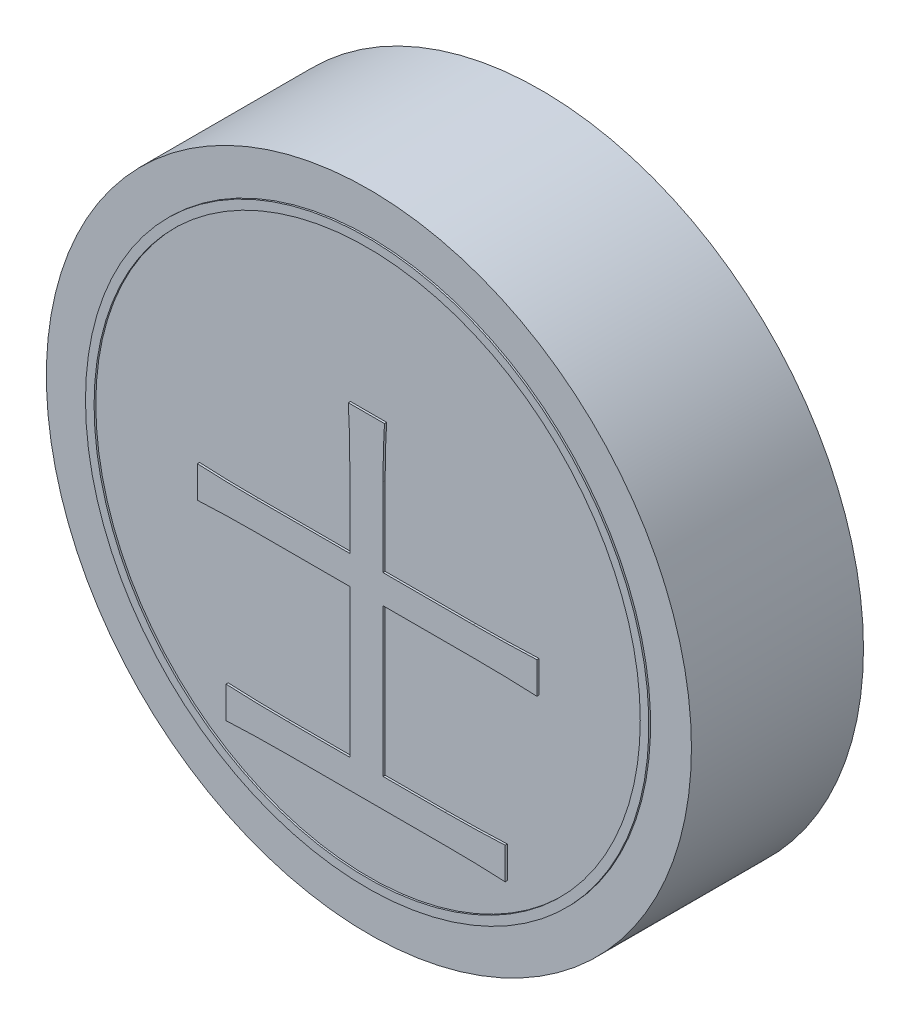
from build123d import *

# Parameters (mm, degrees)
SKETCH_1_R               = 15
DIAMETER30_HEIGHT8_DEPTH = 8
CHARACTER_DEPTH          = 0.1
SKETCH_3_R               = 13.1
SKETCH_3_R_2             = 12.7
INK_RING_DEPTH           = 0.08


with BuildPart() as part:
    # 草图1 → Diameter30_Height8 (new body)
    with BuildSketch(Plane.XY):
        Circle(SKETCH_1_R)
    extrude(amount=-DIAMETER30_HEIGHT8_DEPTH)

    # 草图2 → Character_士 (add)
    with BuildSketch(Plane.XY):
        with BuildLine():
            add(Edge.make_bspline(
                [(0.824561404, 6.026315789), (0.813336636, 5.83662132), (0.790538423, 5.45133988), (0.771428603, 4.863755794), (0.757740418, 4.258132362), (0.755515021, 3.84828648), (0.754385965, 3.640350877)],
                knots=[0, 0, 0, 0, 0.955126267, 1.939921735, 2.954817811, 4, 4, 4, 4], degree=3))
            Line((0.754385965, 3.640350877), (0.754385965, -0.00877193))
            Line((0.754385965, -0.00877193), (4.964912281, -0.00877193))
            add(Edge.make_bspline(
                [(4.964912281, -0.00877193), (5.184108112, -0.007529011), (5.640726, -0.004939824), (6.351162704, 0.009012072), (7.114519154, 0.028890494), (7.640265954, 0.050317465), (7.912280702, 0.061403509)],
                knots=[0, 0, 0, 0, 0.89213577, 1.858452998, 2.891990654, 4, 4, 4, 4], degree=3))
            Line((7.912280702, 0.061403509), (7.912280702, -1.412280702))
            add(Edge.make_bspline(
                [(7.912280702, -1.412280702), (7.427185378, -1.392141242), (6.468519002, -1.352340771), (5.509053521, -1.345489646), (5.035087719, -1.342105263)],
                knots=[0, 0, 0, 0, 1.012021148, 2, 2, 2, 2], degree=3))
            Line((5.035087719, -1.342105263), (0.754385965, -1.342105263))
            Line((0.754385965, -1.342105263), (0.754385965, -8.219298246))
            Line((0.754385965, -8.219298246), (3.631578947, -8.219298246))
            add(Edge.make_bspline(
                [(3.631578947, -8.219298246), (3.848176317, -8.218087826), (4.292668001, -8.215603856), (4.977115293, -8.20161515), (5.696306453, -8.181989949), (6.187377565, -8.160246287), (6.438596491, -8.149122807)],
                knots=[0, 0, 0, 0, 0.925596292, 1.899468382, 2.925423867, 4, 4, 4, 4], degree=3))
            Line((6.438596491, -8.149122807), (6.438596491, -9.622807018))
            add(Edge.make_bspline(
                [(6.438596491, -9.622807018), (6.22377323, -9.611572963), (5.785618359, -9.588659914), (5.114015233, -9.569582266), (4.416560018, -9.555980066), (3.942610691, -9.553759864), (3.701754386, -9.552631579)],
                knots=[0, 0, 0, 0, 0.942753637, 1.922846234, 2.944411245, 4, 4, 4, 4], degree=3))
            Line((3.701754386, -9.552631579), (-3.666666667, -9.552631579))
            add(Edge.make_bspline(
                [(-3.666666667, -9.552631579), (-3.919651707, -9.553757661), (-4.416990585, -9.555971406), (-5.149099093, -9.569586009), (-5.855343836, -9.588750323), (-6.316905199, -9.61158096), (-6.543859649, -9.622807018)],
                knots=[0, 0, 0, 0, 1.05470571, 2.07342756, 3.052684594, 4, 4, 4, 4], degree=3))
            Line((-6.543859649, -9.622807018), (-6.543859649, -8.149122807))
            add(Edge.make_bspline(
                [(-6.543859649, -8.149122807), (-6.326438065, -8.160395624), (-5.876165846, -8.183741218), (-5.178554503, -8.202420094), (-4.436918096, -8.216076814), (-3.928315814, -8.218203947), (-3.666666667, -8.219298246)],
                knots=[0, 0, 0, 0, 0.907617697, 1.879643343, 2.909187922, 4, 4, 4, 4], degree=3))
            Line((-3.666666667, -8.219298246), (-0.789473684, -8.219298246))
            Line((-0.789473684, -8.219298246), (-0.789473684, -1.342105263))
            Line((-0.789473684, -1.342105263), (-5.140350877, -1.342105263))
            add(Edge.make_bspline(
                [(-5.140350877, -1.342105263), (-5.390737734, -1.343192376), (-5.875950755, -1.345299041), (-6.582068481, -1.358952048), (-7.244168345, -1.377670192), (-7.671036038, -1.401009107), (-7.877192982, -1.412280702)],
                knots=[0, 0, 0, 0, 1.097340975, 2.126485934, 3.095181147, 4, 4, 4, 4], degree=3))
            Line((-7.877192982, -1.412280702), (-7.877192982, 0.061403509))
            add(Edge.make_bspline(
                [(-7.877192982, 0.061403509), (-7.671036038, 0.050131914), (-7.244168345, 0.026792999), (-6.582068481, 0.008074855), (-5.875950755, -0.005578152), (-5.390737734, -0.007684817), (-5.140350877, -0.00877193)],
                knots=[0, 0, 0, 0, 0.904818853, 1.873514066, 2.902659025, 4, 4, 4, 4], degree=3))
            Line((-5.140350877, -0.00877193), (-0.789473684, -0.00877193))
            Line((-0.789473684, -0.00877193), (-0.789473684, 3.640350877))
            add(Edge.make_bspline(
                [(-0.789473684, 3.640350877), (-0.790602741, 3.84828648), (-0.792828137, 4.258132362), (-0.806516322, 4.863755794), (-0.825626143, 5.45133988), (-0.848424355, 5.83662132), (-0.859649123, 6.026315789)],
                knots=[0, 0, 0, 0, 1.045182189, 2.060078265, 3.044873733, 4, 4, 4, 4], degree=3))
            Line((-0.859649123, 6.026315789), (0.824561404, 6.026315789))
        make_face()
    extrude(amount=CHARACTER_DEPTH)

    # 草图3 → Ink_ring (add)
    with BuildSketch(Plane.XY):
        with Locations(Location((0, 0, 0), (0, 0, 180))):
            Circle(SKETCH_3_R)
        with Locations(Location((0, 0, 0), (0, 0, 180))):
            Circle(SKETCH_3_R_2, mode=Mode.SUBTRACT)
    extrude(amount=INK_RING_DEPTH)


solid = part.part
